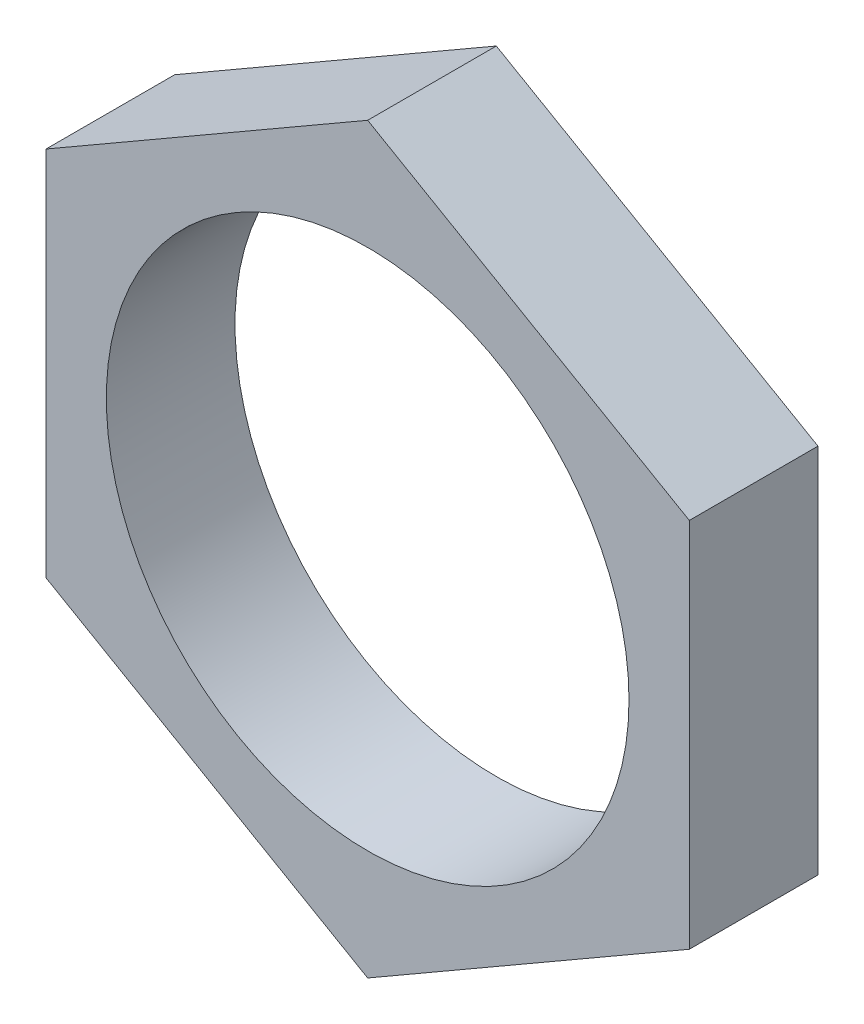
from build123d import *

# Parameters (mm, degrees)
SKETCH_1_R      = 3.25
EXTRUDE_1_DEPTH = 1.6


with BuildPart() as part:
    # Эскиз1 → Вытянуть1 (new body)
    with BuildSketch(Plane.XY):
        Polygon((-4, 2.309401077), (-4, -2.309401077), (0, -4.618802154), (4, -2.309401077), (4, 2.309401077), (0, 4.618802154), align=None)
        Circle(SKETCH_1_R, mode=Mode.SUBTRACT)
    extrude(amount=EXTRUDE_1_DEPTH)


solid = part.part
